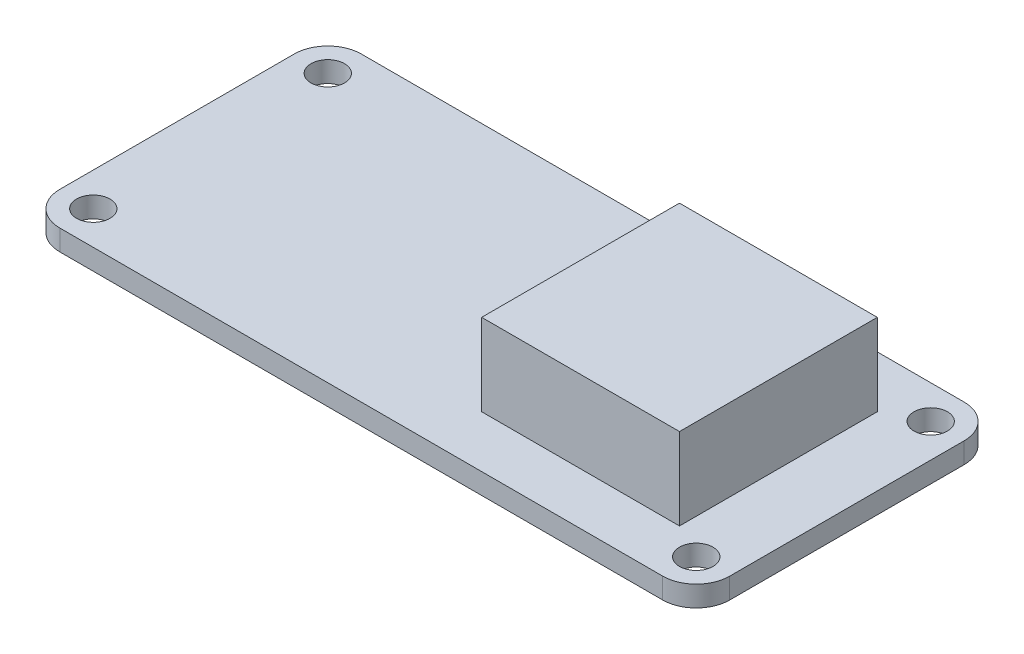
from build123d import *

# Parameters (mm, degrees)
SKETCH1_W                = 50.8
SKETCH1_H                = 22.86
BOSS_EXTRUDE1_DEPTH      = 1.57
F_1_16_0_1_DOWEL_HOLE1_D = 2.54
FILLET1_R                = 2.54
SKETCH2_W                = 15
SKETCH2_H                = 15
BOSS_EXTRUDE2_DEPTH      = 6.2


with BuildPart() as part:
    # Sketch1 → Boss-Extrude1 (new body)
    with BuildSketch(Plane(origin=(0, 0, 0), x_dir=(1, 0, 0), z_dir=(0, 1, 0))):
        Rectangle(SKETCH1_W, SKETCH1_H)
    extrude(amount=BOSS_EXTRUDE1_DEPTH)

    # 1/16 (0.1) Dowel Hole1 (through all)
    with Locations(Plane(origin=(-22.86, 1.57, -8.89), x_dir=(0, 0, 1), z_dir=(0, 1, 0))):
        with Locations((0, 0), (0, 45.72), (17.78, 45.72), (17.78, 0)):
            Hole(F_1_16_0_1_DOWEL_HOLE1_D / 2)

    # Fillet1
    fillet1_edges = [part.edges().sort_by_distance(p)[0] for p in [
        (25.4, 0.785, 11.43),
        (-25.4, 0.785, 11.43),
        (-25.4, 0.785, -11.43),
        (25.4, 0.785, -11.43),
    ]]
    fillet(fillet1_edges, radius=FILLET1_R)

    # Sketch2 → Boss-Extrude2 (add)
    with BuildSketch(Plane(origin=(0, 1.57, 0), x_dir=(1, 0, 0), z_dir=(0, 1, 0))):
        with Locations((12.7, 0)):
            Rectangle(SKETCH2_W, SKETCH2_H)
    extrude(amount=BOSS_EXTRUDE2_DEPTH)


solid = part.part
